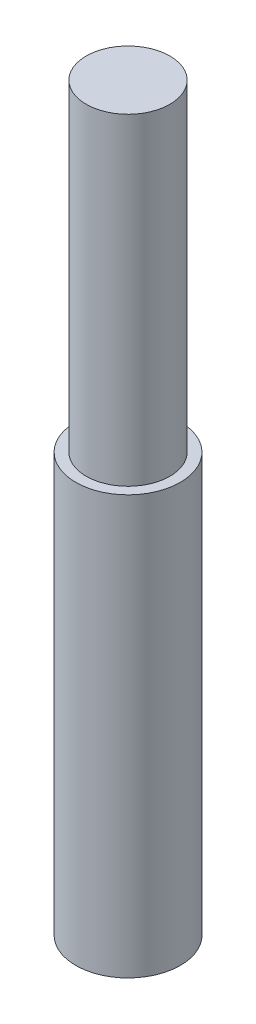
from build123d import *

# Parameters (mm, degrees)
IZIM2_R               = 2
KES_EKSTR_ZYON1_DEPTH = 10
RADYUS1_R             = 0.4


with BuildPart() as part:
    # Çizim1 → Döndür1 (revolve)
    with BuildSketch(Plane.XY, mode=Mode.PRIVATE) as d_nd_r1_sk:
        Polygon((0, 0), (0, 35.4), (2, 35.4), (2, 20), (2.5, 20), (2.5, 0), align=None)
    revolve(d_nd_r1_sk.sketch.rotate(Axis((0, 0, 0), (0, 1, 0)), 90), axis=Axis((0, 0, 0), (0, 1, 0)))

    # Çizim2 → Kes-Ekstrüzyon1 (cut)
    with BuildSketch(Plane.XZ):
        with Locations(Location((0, 0, 0), (0, 0, 270))):
            Circle(IZIM2_R)
    extrude(amount=-KES_EKSTR_ZYON1_DEPTH, mode=Mode.SUBTRACT)

    # Radyus1
    radyus1_edges = [part.edges().sort_by_distance(p)[0] for p in [
        (0, 0, 2),
    ]]
    fillet(radyus1_edges, radius=RADYUS1_R)


solid = part.part
